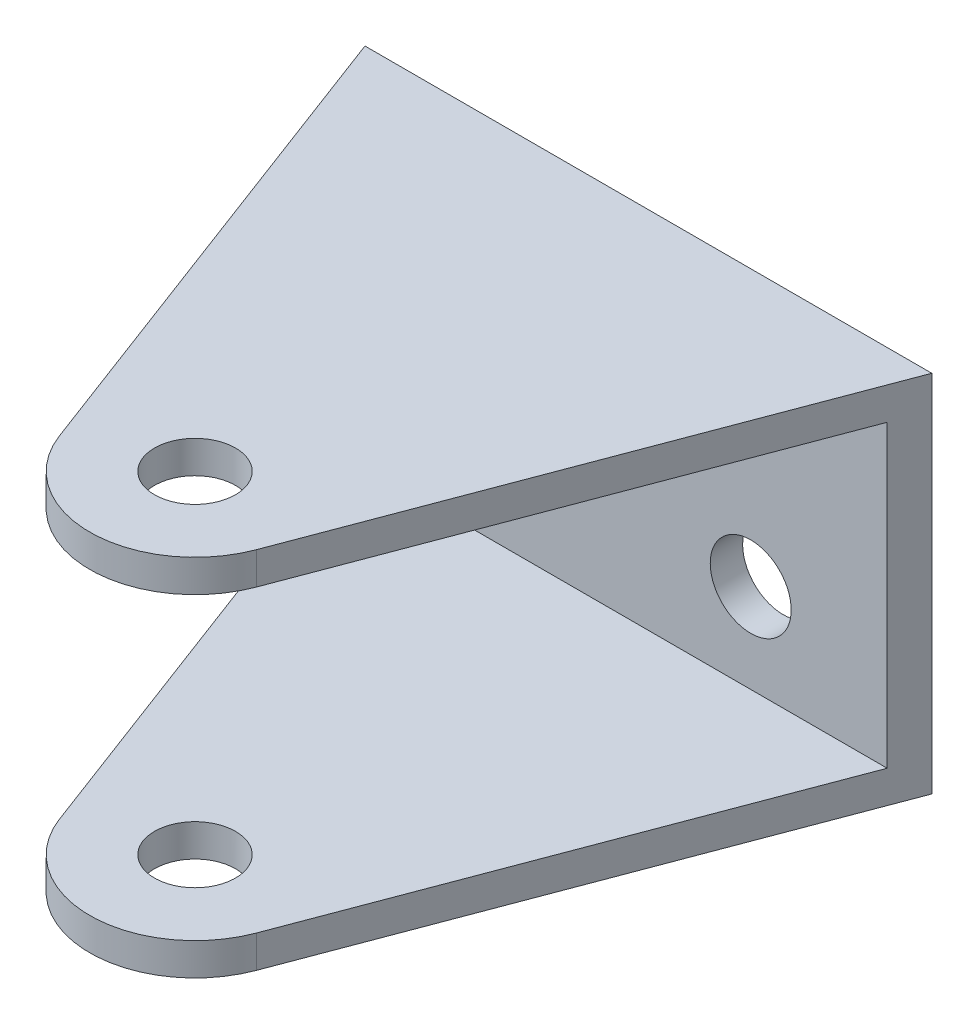
from build123d import *

# Parameters (mm, degrees)
SKETCH1_W               = 70
SKETCH1_H               = 45
SKETCH1_R               = 5
BOSS_EXTRUDE1_DEPTH     = 70
SKETCH2_R               = 5
CUT_EXTRUDE1_DEPTH      = 70
CUT_EXTRUDE2_DEPTH      = 181.24938524
CUT_EXTRUDE2_DEPTH_BACK = 181.24938524
SKETCH3_W               = 72.235560481
SKETCH3_H               = 37


with BuildPart() as part:
    # Sketch1 → Boss-Extrude1 (new body)
    with BuildSketch(Plane.XY.offset(32.9)):
        with Locations((0.858254713, 121.799876296)):
            Rectangle(SKETCH1_W, SKETCH1_H)
        with Locations((-17.5, 114.3)):
            Circle(SKETCH1_R, mode=Mode.SUBTRACT)
        with Locations((17.5, 114.3)):
            Circle(SKETCH1_R, mode=Mode.SUBTRACT)
    extrude(amount=BOSS_EXTRUDE1_DEPTH)

    # Sketch2 → Cut-Extrude1 (cut)
    with BuildSketch(Plane(origin=(0, 144.299876296, 0), x_dir=(1, 0, 0), z_dir=(0, 1, 0))):
        with BuildLine():
            Line((0.858254713, -101.89), (0.858254713, -102.9))
            Line((0.858254713, -102.9), (35.858254713, -102.9))
            Line((35.858254713, -102.9), (35.858254713, -32.9))
            Line((35.858254713, -32.9), (13.022608826, -93.475683049))
            ThreePointArc((13.022608826, -93.475683049), (8.253730369, -99.581442364), (0.858254713, -101.89))
        make_face()
        with BuildLine():
            Line((-34.141745287, -102.9), (0.858254713, -102.9))
            Line((0.858254713, -102.9), (0.858254713, -101.89))
            ThreePointArc((0.858254713, -101.89), (-6.537220943, -99.581442364), (-11.306099399, -93.475683049))
            Line((-11.306099399, -93.475683049), (-34.141745287, -32.9))
            Line((-34.141745287, -32.9), (-34.141745287, -102.9))
        make_face()
        with Locations(Location((0.858254713, -88.89, 0), (0, 0, 270))):
            Circle(SKETCH2_R)
    extrude(amount=-CUT_EXTRUDE1_DEPTH, mode=Mode.SUBTRACT)

    # Sketch3 → Cut-Extrude2 (cut, two sides: drawn at the far end of the back side and taken through both)
    with BuildSketch(Plane(origin=(0, 0, 0), x_dir=(0, 0, -1), z_dir=(1, 0, 0)).offset(-CUT_EXTRUDE2_DEPTH_BACK)):
        with Locations((-73.017780241, 121.799876296)):
            Rectangle(SKETCH3_W, SKETCH3_H)
    extrude(amount=CUT_EXTRUDE2_DEPTH + CUT_EXTRUDE2_DEPTH_BACK, mode=Mode.SUBTRACT)


solid = part.part
